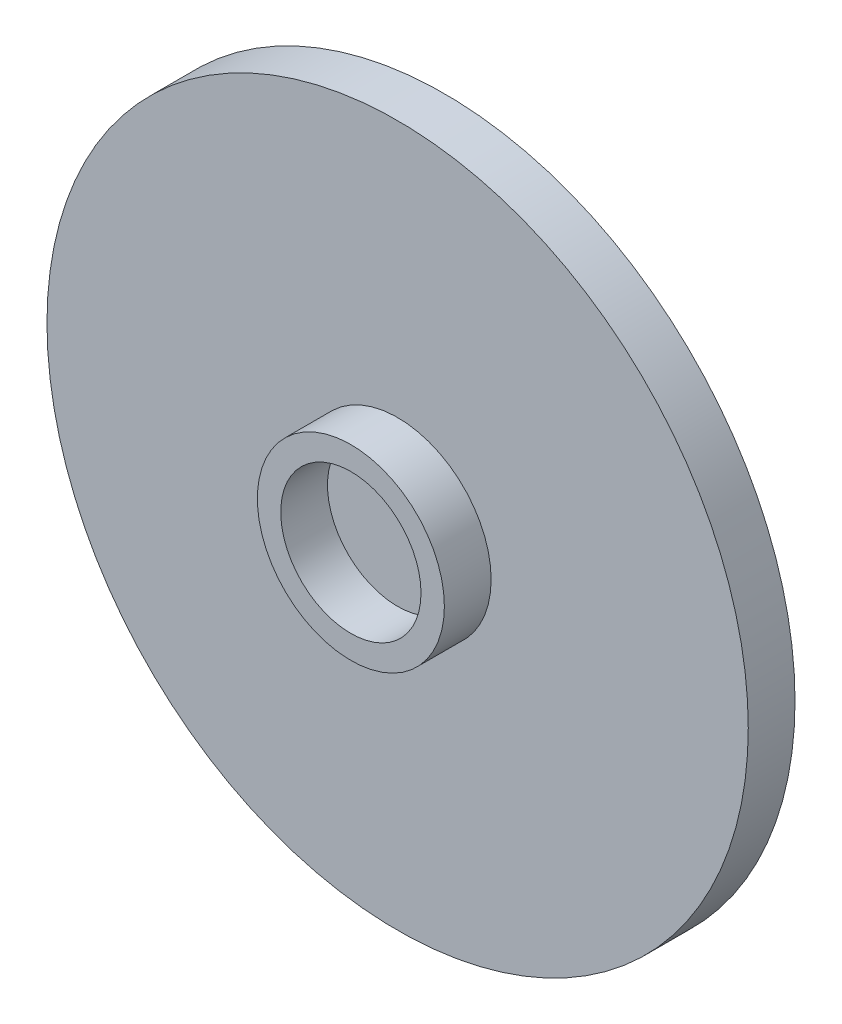
from build123d import *

# Parameters (mm, degrees)
SKETCH1_R           = 11.90625
BOSS_EXTRUDE1_DEPTH = 1.5875
SKETCH2_R           = 3.175
SKETCH2_R_2         = 2.38125
BOSS_EXTRUDE2_DEPTH = 1.5875


with BuildPart() as part:
    # Sketch1 → Boss-Extrude1 (new body)
    with BuildSketch(Plane.XY):
        Circle(SKETCH1_R)
    extrude(amount=BOSS_EXTRUDE1_DEPTH)

    # Sketch2 → Boss-Extrude2 (add)
    with BuildSketch(Plane.XY.offset(1.5875)):
        Circle(SKETCH2_R)
        Circle(SKETCH2_R_2, mode=Mode.SUBTRACT)
    extrude(amount=BOSS_EXTRUDE2_DEPTH)


solid = part.part
